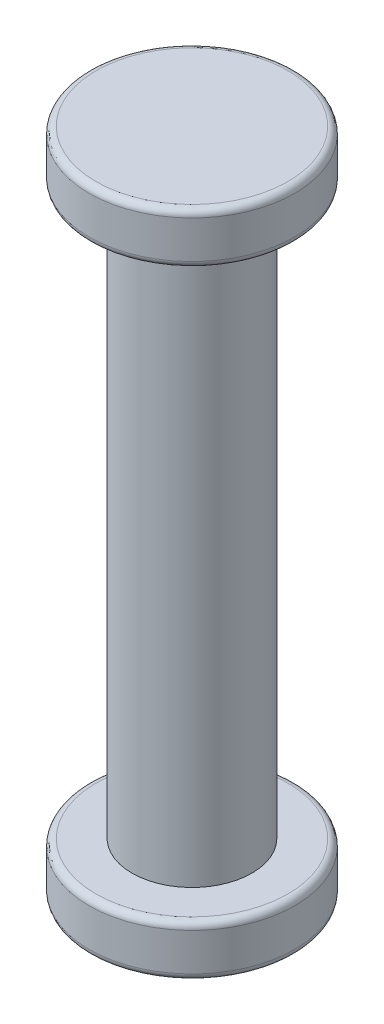
from build123d import *

# Parameters (mm, degrees)
SKETCH1_R           = 1.75
BOSS_EXTRUDE1_DEPTH = 8.25


with BuildPart() as part:
    # Sketch1 → Boss-Extrude1 (new, symmetric)
    with BuildSketch(Plane(origin=(0, 0, 0), x_dir=(1, 0, 0), z_dir=(0, 1, 0))):
        with Locations(Location((0, 0, 0), (0, 0, 270))):
            Circle(SKETCH1_R)
    extrude(amount=BOSS_EXTRUDE1_DEPTH, both=True)

    # Sketch2 → Revolve2 (revolve)
    with BuildSketch(Plane.XY, mode=Mode.PRIVATE) as revolve2_sk:
        with BuildLine():
            Line((-2.8, 8.25), (0, 8.25))
            Line((0, 8.25), (0, 9.75))
            Line((0, 9.75), (-2.8, 9.75))
            ThreePointArc((-2.8, 9.75), (-2.941421356, 9.691421356), (-3, 9.55))
            Line((-3, 9.55), (-3, 8.45))
            ThreePointArc((-3, 8.45), (-2.941421356, 8.308578644), (-2.8, 8.25))
        make_face()
        with BuildLine():
            Line((0, -9.75), (0, -8.25))
            Line((0, -8.25), (-2.8, -8.25))
            ThreePointArc((-2.8, -8.25), (-2.941421356, -8.308578644), (-3, -8.45))
            Line((-3, -8.45), (-3, -9.55))
            ThreePointArc((-3, -9.55), (-2.941421356, -9.691421356), (-2.8, -9.75))
            Line((-2.8, -9.75), (0, -9.75))
        make_face()
    revolve(revolve2_sk.sketch.rotate(Axis((0, 9.75, 0), (0, -1, 0)), 270), axis=Axis((0, 9.75, 0), (0, -1, 0)))


solid = part.part
